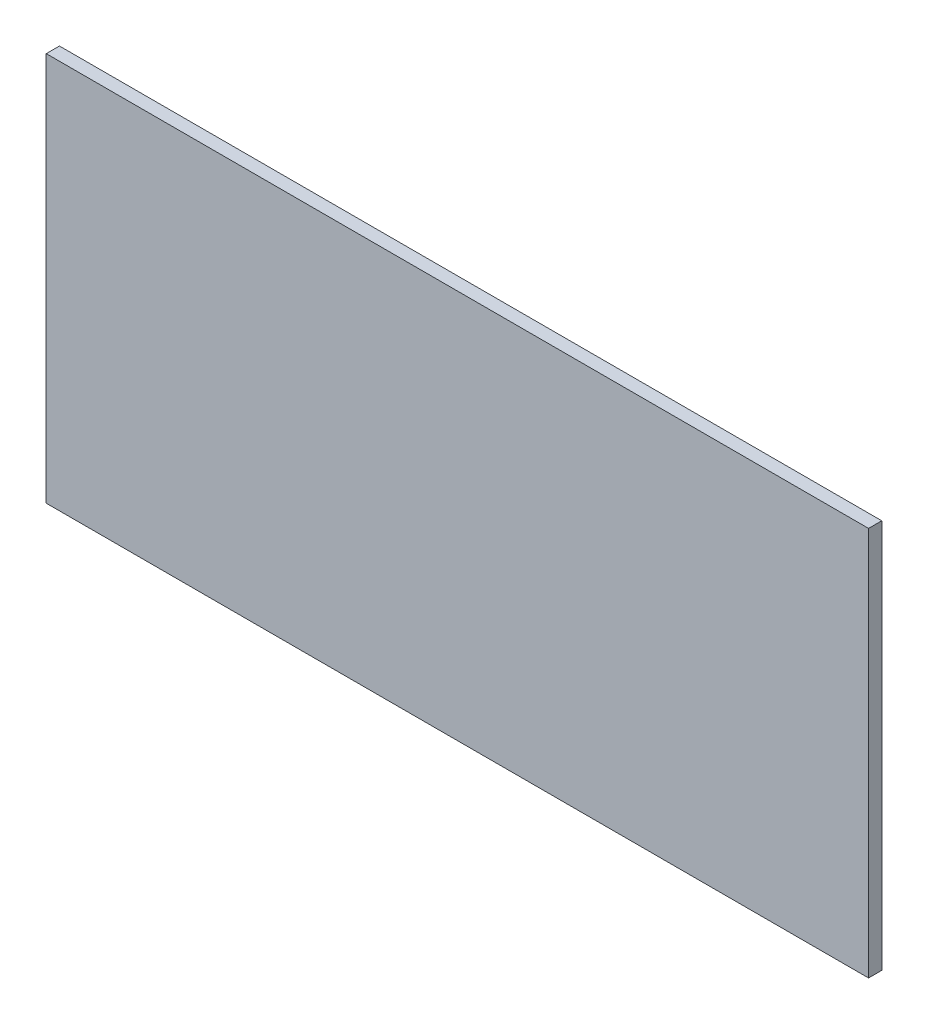
from build123d import *

# Parameters (mm, degrees)
SKETCH_1_W      = 62.3
SKETCH_1_H      = 29.5
EXTRUDE_1_DEPTH = 1


with BuildPart() as part:
    # Эскиз1 → Бобышка-Вытянуть1 (new body)
    with BuildSketch(Plane.XY):
        with Locations((-2.9, 0)):
            Rectangle(SKETCH_1_W, SKETCH_1_H)
    extrude(amount=EXTRUDE_1_DEPTH)


solid = part.part
